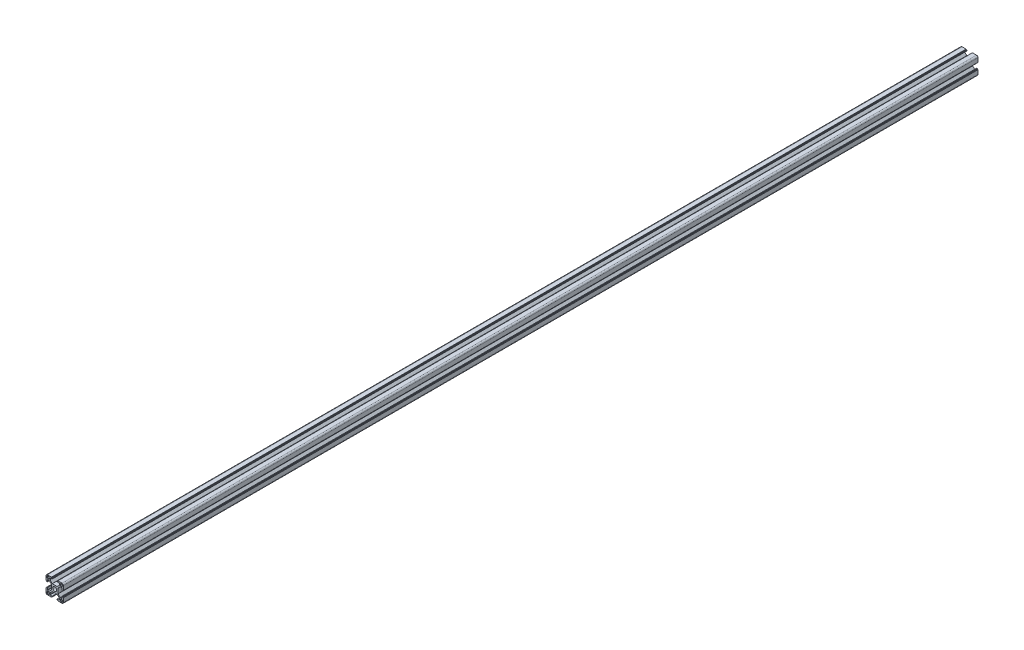
from build123d import *

# Parameters (mm, degrees)
MODEL_R             = 6.8
BOSS_EXTRUDE1_DEPTH = 3150
SCALE1_SCALE        = 0.333333333


with BuildPart() as part:
    # Model → Boss-Extrude1 (new body)
    with BuildSketch(Plane.XY):
        with BuildLine():
            Line((0, 11.6), (-8.240202025, 11.6))
            ThreePointArc((-8.240202025, 11.6), (-8.469812085, 11.64567228), (-8.664466094, 11.775735931))
            Line((-8.664466094, 11.775735931), (-16.324264069, 19.435533906))
            ThreePointArc((-16.324264069, 19.435533906), (-16.45432772, 19.630187915), (-16.5, 19.859797975))
            Line((-16.5, 19.859797975), (-16.5, 25))
            ThreePointArc((-16.5, 25), (-16.324264069, 25.424264069), (-15.9, 25.6))
            Line((-15.9, 25.6), (-8.8, 25.6))
            ThreePointArc((-8.8, 25.6), (-8.375735931, 25.775735931), (-8.2, 26.2))
            Line((-8.2, 26.2), (-8.2, 27.4))
            ThreePointArc((-8.2, 27.4), (-8.375735931, 27.824264069), (-8.8, 28))
            Line((-8.8, 28), (-9.8, 28))
            ThreePointArc((-9.8, 28), (-10.224264069, 28.175735931), (-10.4, 28.6))
            Line((-10.4, 28.6), (-10.4, 29.4))
            ThreePointArc((-10.4, 29.4), (-10.575735931, 29.824264069), (-10.999999999, 30))
            Line((-10.999999999, 30), (-25, 30))
            ThreePointArc((-25, 30), (-28.535533906, 28.535533906), (-30, 25))
            Line((-30, 25), (-30, 11))
            ThreePointArc((-30, 11), (-29.824264069, 10.575735931), (-29.4, 10.4))
            Line((-29.4, 10.4), (-28.6, 10.4))
            ThreePointArc((-28.6, 10.4), (-28.175735931, 10.224264069), (-28, 9.8))
            Line((-28, 9.8), (-28, 8.8))
            ThreePointArc((-28, 8.8), (-27.824264069, 8.375735931), (-27.4, 8.2))
            Line((-27.4, 8.2), (-26.2, 8.2))
            ThreePointArc((-26.2, 8.2), (-25.775735931, 8.375735931), (-25.6, 8.8))
            Line((-25.6, 8.8), (-25.6, 15.9))
            ThreePointArc((-25.6, 15.9), (-25.424264069, 16.324264069), (-25, 16.5))
            Line((-25, 16.5), (-19.859797974, 16.5))
            ThreePointArc((-19.859797974, 16.5), (-19.630187915, 16.454327719), (-19.435533906, 16.324264068))
            Line((-19.435533906, 16.324264068), (-11.775735931, 8.664466094))
            ThreePointArc((-11.775735931, 8.664466094), (-11.64567228, 8.469812085), (-11.6, 8.240202025))
            Line((-11.6, 8.240202025), (-11.6, 0))
            Line((-11.6, 0), (-11.6, -8.240202025))
            ThreePointArc((-11.6, -8.240202025), (-11.64567228, -8.469812085), (-11.775735931, -8.664466094))
            Line((-11.775735931, -8.664466094), (-19.435533906, -16.324264068))
            ThreePointArc((-19.435533906, -16.324264068), (-19.630187915, -16.454327719), (-19.859797974, -16.5))
            Line((-19.859797974, -16.5), (-25, -16.5))
            ThreePointArc((-25, -16.5), (-25.424264069, -16.324264069), (-25.6, -15.9))
            Line((-25.6, -15.9), (-25.6, -8.8))
            ThreePointArc((-25.6, -8.8), (-25.775735931, -8.375735931), (-26.2, -8.2))
            Line((-26.2, -8.2), (-27.4, -8.2))
            ThreePointArc((-27.4, -8.2), (-27.824264069, -8.375735931), (-28, -8.8))
            Line((-28, -8.8), (-28, -9.8))
            ThreePointArc((-28, -9.8), (-28.175735931, -10.224264069), (-28.6, -10.4))
            Line((-28.6, -10.4), (-29.4, -10.4))
            ThreePointArc((-29.4, -10.4), (-29.824264069, -10.575735931), (-30, -11))
            Line((-30, -11), (-30, -25))
            ThreePointArc((-30, -25), (-28.535533906, -28.535533906), (-25, -30))
            Line((-25, -30), (-10.999999999, -30))
            ThreePointArc((-10.999999999, -30), (-10.575735931, -29.824264069), (-10.4, -29.4))
            Line((-10.4, -29.4), (-10.4, -28.6))
            ThreePointArc((-10.4, -28.6), (-10.224264069, -28.175735931), (-9.8, -28))
            Line((-9.8, -28), (-8.8, -28))
            ThreePointArc((-8.8, -28), (-8.375735931, -27.824264069), (-8.2, -27.4))
            Line((-8.2, -27.4), (-8.2, -26.2))
            ThreePointArc((-8.2, -26.2), (-8.375735931, -25.775735931), (-8.8, -25.6))
            Line((-8.8, -25.6), (-15.9, -25.6))
            ThreePointArc((-15.9, -25.6), (-16.324264069, -25.424264069), (-16.5, -25))
            Line((-16.5, -25), (-16.5, -19.859797975))
            ThreePointArc((-16.5, -19.859797975), (-16.45432772, -19.630187915), (-16.324264069, -19.435533906))
            Line((-16.324264069, -19.435533906), (-8.664466094, -11.775735931))
            ThreePointArc((-8.664466094, -11.775735931), (-8.469812085, -11.64567228), (-8.240202025, -11.6))
            Line((-8.240202025, -11.6), (0, -11.6))
            Line((0, -11.6), (8.240202025, -11.6))
            ThreePointArc((8.240202025, -11.6), (8.469812085, -11.64567228), (8.664466094, -11.775735931))
            Line((8.664466094, -11.775735931), (16.324264069, -19.435533906))
            ThreePointArc((16.324264069, -19.435533906), (16.45432772, -19.630187915), (16.5, -19.859797975))
            Line((16.5, -19.859797975), (16.5, -25))
            ThreePointArc((16.5, -25), (16.324264069, -25.424264069), (15.9, -25.6))
            Line((15.9, -25.6), (8.8, -25.6))
            ThreePointArc((8.8, -25.6), (8.375735931, -25.775735931), (8.2, -26.2))
            Line((8.2, -26.2), (8.2, -27.4))
            ThreePointArc((8.2, -27.4), (8.375735931, -27.824264069), (8.8, -28))
            Line((8.8, -28), (9.8, -28))
            ThreePointArc((9.8, -28), (10.224264069, -28.175735931), (10.4, -28.6))
            Line((10.4, -28.6), (10.4, -29.4))
            ThreePointArc((10.4, -29.4), (10.575735931, -29.824264069), (10.999999999, -30))
            Line((10.999999999, -30), (25, -30))
            ThreePointArc((25, -30), (28.535533906, -28.535533906), (30, -25))
            Line((30, -25), (30, -11))
            ThreePointArc((30, -11), (29.824264069, -10.575735931), (29.4, -10.4))
            Line((29.4, -10.4), (28.6, -10.4))
            ThreePointArc((28.6, -10.4), (28.175735931, -10.224264069), (28, -9.8))
            Line((28, -9.8), (28, -8.8))
            ThreePointArc((28, -8.8), (27.824264069, -8.375735931), (27.4, -8.2))
            Line((27.4, -8.2), (26.2, -8.2))
            ThreePointArc((26.2, -8.2), (25.775735931, -8.375735931), (25.6, -8.8))
            Line((25.6, -8.8), (25.6, -15.9))
            ThreePointArc((25.6, -15.9), (25.424264069, -16.324264069), (25, -16.5))
            Line((25, -16.5), (19.859797974, -16.5))
            ThreePointArc((19.859797974, -16.5), (19.630187915, -16.454327719), (19.435533906, -16.324264068))
            Line((19.435533906, -16.324264068), (11.775735931, -8.664466094))
            ThreePointArc((11.775735931, -8.664466094), (11.64567228, -8.469812085), (11.6, -8.240202025))
            Line((11.6, -8.240202025), (11.6, 0))
            Line((11.6, 0), (11.6, 8.240202025))
            ThreePointArc((11.6, 8.240202025), (11.64567228, 8.469812085), (11.775735931, 8.664466094))
            Line((11.775735931, 8.664466094), (19.611269837, 16.5))
            Line((19.611269837, 16.5), (25, 16.5))
            ThreePointArc((25, 16.5), (25.424264069, 16.324264069), (25.6, 15.9))
            Line((25.6, 15.9), (25.6, 8.8))
            ThreePointArc((25.6, 8.8), (25.775735931, 8.375735931), (26.2, 8.2))
            Line((26.2, 8.2), (27.4, 8.2))
            ThreePointArc((27.4, 8.2), (27.824264069, 8.375735931), (28, 8.8))
            Line((28, 8.8), (28, 9.8))
            ThreePointArc((28, 9.8), (28.175735931, 10.224264069), (28.6, 10.4))
            Line((28.6, 10.4), (29.4, 10.4))
            ThreePointArc((29.4, 10.4), (29.824264069, 10.575735931), (30, 11))
            Line((30, 11), (30, 25))
            ThreePointArc((30, 25), (28.535533906, 28.535533906), (25, 30))
            Line((25, 30), (10.999999999, 30))
            ThreePointArc((10.999999999, 30), (10.575735931, 29.824264069), (10.4, 29.4))
            Line((10.4, 29.4), (10.4, 28.6))
            ThreePointArc((10.4, 28.6), (10.224264069, 28.175735931), (9.8, 28))
            Line((9.8, 28), (8.8, 28))
            ThreePointArc((8.8, 28), (8.375735931, 27.824264069), (8.2, 27.4))
            Line((8.2, 27.4), (8.2, 26.2))
            ThreePointArc((8.2, 26.2), (8.375735931, 25.775735931), (8.8, 25.6))
            Line((8.8, 25.6), (15.9, 25.6))
            ThreePointArc((15.9, 25.6), (16.324264069, 25.424264069), (16.5, 25))
            Line((16.5, 25), (16.5, 19.859797975))
            ThreePointArc((16.5, 19.859797975), (16.45432772, 19.630187915), (16.324264069, 19.435533906))
            Line((16.324264069, 19.435533906), (8.664466094, 11.775735931))
            ThreePointArc((8.664466094, 11.775735931), (8.469812085, 11.64567228), (8.240202025, 11.6))
            Line((8.240202025, 11.6), (0, 11.6))
        make_face()
        with Locations(Location((0, 0, 0), (0, 0, 180))):
            Circle(MODEL_R, mode=Mode.SUBTRACT)
        with BuildLine():
            Line((21.5, 27), (25, 27))
            ThreePointArc((25, 27), (26.414213562, 26.414213562), (27, 25))
            Line((27, 25), (27, 21.5))
            ThreePointArc((27, 21.5), (26.414213562, 20.085786438), (25, 19.5))
            Line((25, 19.5), (21.5, 19.5))
            ThreePointArc((21.5, 19.5), (20.085786438, 20.085786438), (19.5, 21.5))
            Line((19.5, 21.5), (19.5, 25))
            ThreePointArc((19.5, 25), (20.085786438, 26.414213562), (21.5, 27))
        make_face(mode=Mode.SUBTRACT)
        with BuildLine():
            Line((21.5, -27), (25, -27))
            ThreePointArc((25, -27), (26.414213562, -26.414213562), (27, -25))
            Line((27, -25), (27, -21.5))
            ThreePointArc((27, -21.5), (26.414213562, -20.085786438), (25, -19.5))
            Line((25, -19.5), (21.5, -19.5))
            ThreePointArc((21.5, -19.5), (20.085786438, -20.085786438), (19.5, -21.5))
            Line((19.5, -21.5), (19.5, -25))
            ThreePointArc((19.5, -25), (20.085786438, -26.414213562), (21.5, -27))
        make_face(mode=Mode.SUBTRACT)
        with BuildLine():
            Line((-21.5, -27), (-25, -27))
            ThreePointArc((-25, -27), (-26.414213562, -26.414213562), (-27, -25))
            Line((-27, -25), (-27, -21.5))
            ThreePointArc((-27, -21.5), (-26.414213562, -20.085786438), (-25, -19.5))
            Line((-25, -19.5), (-21.5, -19.5))
            ThreePointArc((-21.5, -19.5), (-20.085786438, -20.085786438), (-19.5, -21.5))
            Line((-19.5, -21.5), (-19.5, -25))
            ThreePointArc((-19.5, -25), (-20.085786438, -26.414213562), (-21.5, -27))
        make_face(mode=Mode.SUBTRACT)
        with BuildLine():
            Line((-21.5, 27), (-25, 27))
            ThreePointArc((-25, 27), (-26.414213562, 26.414213562), (-27, 25))
            Line((-27, 25), (-27, 21.5))
            ThreePointArc((-27, 21.5), (-26.414213562, 20.085786438), (-25, 19.5))
            Line((-25, 19.5), (-21.5, 19.5))
            ThreePointArc((-21.5, 19.5), (-20.085786438, 20.085786438), (-19.5, 21.5))
            Line((-19.5, 21.5), (-19.5, 25))
            ThreePointArc((-19.5, 25), (-20.085786438, 26.414213562), (-21.5, 27))
        make_face(mode=Mode.SUBTRACT)
    extrude(amount=BOSS_EXTRUDE1_DEPTH)


with BuildPart() as part_1:
    # Scale1: scaled about (-0.000116359, -9.761e-05, 1575)
    add(part.part.scale(SCALE1_SCALE).moved(Location((-7.7573e-05, -6.5073e-05, 1050))))


solid = part_1.part
